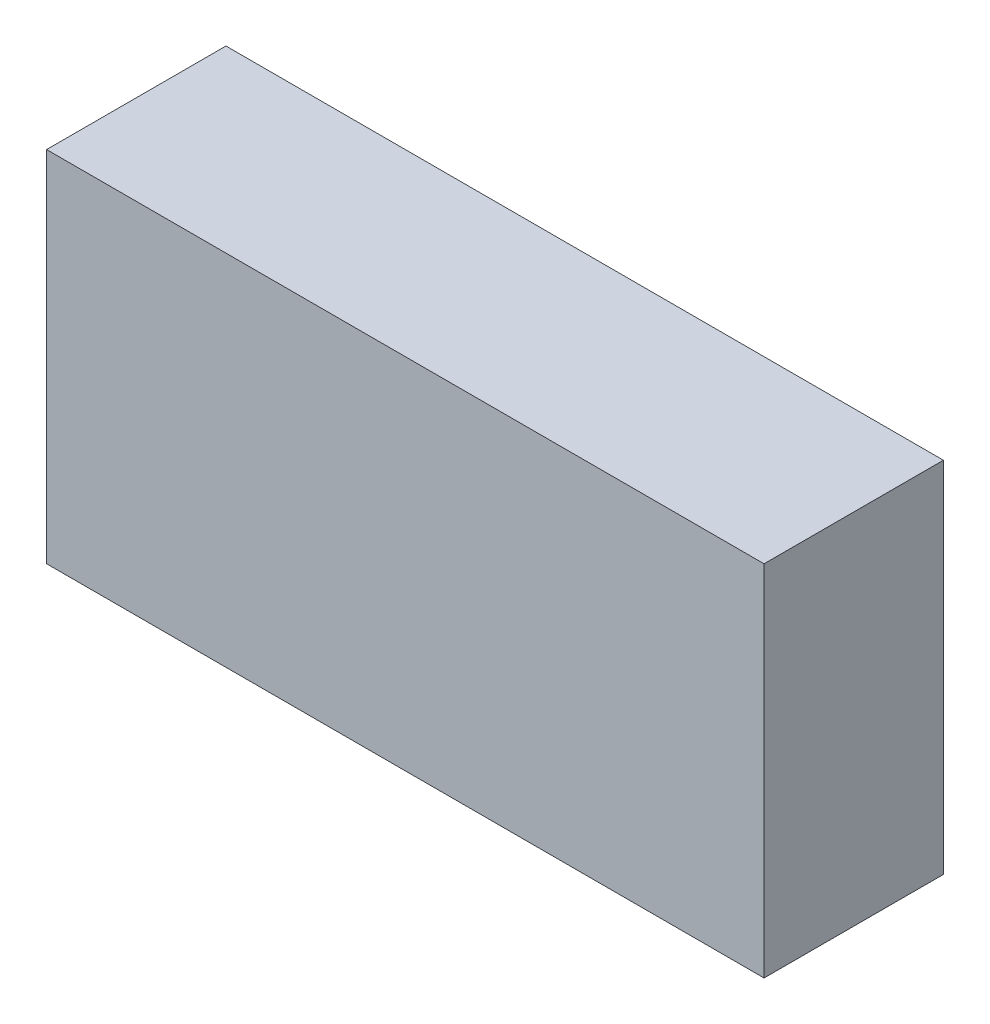
from build123d import *

# Parameters (mm, degrees)
SKETCH1_W           = 50.8
SKETCH1_H           = 25.4
BOSS_EXTRUDE1_DEPTH = 12.7


with BuildPart() as part:
    # Sketch1 → Boss-Extrude1 (new body)
    with BuildSketch(Plane.XY):
        with Locations((25.4, -12.7)):
            Rectangle(SKETCH1_W, SKETCH1_H)
    extrude(amount=BOSS_EXTRUDE1_DEPTH)


solid = part.part
